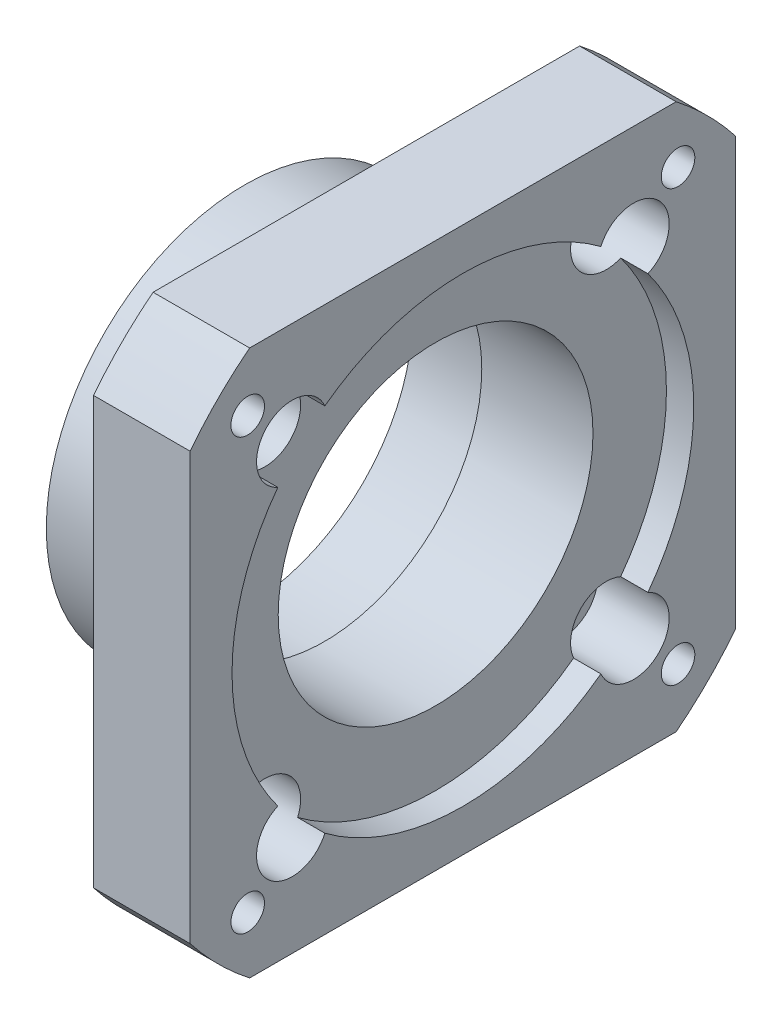
from build123d import *

# Parameters (mm, degrees)
SKETCH_3_OUTSIDE_W           = 214.814
SKETCH_3_OUTSIDE_H           = 214.814
SKETCH_3_OUTSIDE_W_2         = 130
SKETCH_3_OUTSIDE_H_2         = 130
CUT_EXTRUDE_1_DEPTH          = 121.222710001
SKETCH_4_R                   = 4
CUT_EXTRUDE_2_DEPTH          = 106.61249926
HOLE_WIZARD_M6_1_D           = 11
HOLE_WIZARD_M6_1_CBORE_D     = 17
HOLE_WIZARD_M6_1_CBORE_DEPTH = 17
PATTERN_CIRCULAR_1_COUNT     = 4


with BuildPart() as part:
    # 草图2 → 旋转1 (revolve)
    with BuildSketch(Plane.XY, mode=Mode.PRIVATE) as revolve_1_sk:
        Polygon((0, 37.5), (0, 55), (6.5, 55), (6.5, 82.5), (-16.5, 82.5), (-16.5, 47.25), (-45.5, 47.25), (-45.5, 40), (-26.5, 40), (-26.5, 37.5), align=None)
    revolve(revolve_1_sk.sketch.rotate(Axis((0, 0, 0), (1, 0, 0)), 90), axis=Axis((0, 0, 0), (1, 0, 0)))

    # 草图3 outside → 切除-拉伸1 (cut, through all)
    with BuildSketch(Plane.ZY.offset(16.5)):
        Rectangle(SKETCH_3_OUTSIDE_W, SKETCH_3_OUTSIDE_H)
        Rectangle(SKETCH_3_OUTSIDE_W_2, SKETCH_3_OUTSIDE_H_2, mode=Mode.SUBTRACT)
    extrude(amount=-CUT_EXTRUDE_1_DEPTH, mode=Mode.SUBTRACT)

    # 草图4 → 切除-拉伸2 (cut, through all)
    with BuildSketch(Plane.ZY.offset(45.5)):
        with Locations((-51.265241636, 51.265241636)):
            Circle(SKETCH_4_R)
        with Locations((51.265241636, 51.265241636)):
            Circle(SKETCH_4_R)
        with Locations((51.265241636, -51.265241636)):
            Circle(SKETCH_4_R)
        with Locations((-51.265241636, -51.265241636)):
            Circle(SKETCH_4_R)
    extrude(amount=-CUT_EXTRUDE_2_DEPTH, mode=Mode.SUBTRACT)

    # M6 六角头螺栓的柱形沉头孔1 (through all)
    with Locations(Plane(origin=(6.5, 0, 0), x_dir=(0, 0, -1), z_dir=(1, 0, 0))):
        with Locations((40.658639918, 40.658639918)):
            hole_wizard_m6_1 = CounterBoreHole(HOLE_WIZARD_M6_1_D / 2, HOLE_WIZARD_M6_1_CBORE_D / 2, HOLE_WIZARD_M6_1_CBORE_DEPTH)

    # 阵列(圆周)1: M6 六角头螺栓的柱形沉头孔1 ×4 about axis
    pattern_circular_1_axis = Axis((0, 0, 0), (1, 0, 0))
    for i in range(1, PATTERN_CIRCULAR_1_COUNT):
        add(hole_wizard_m6_1.rotate(pattern_circular_1_axis, i * 360 / PATTERN_CIRCULAR_1_COUNT), mode=Mode.SUBTRACT)


solid = part.part
